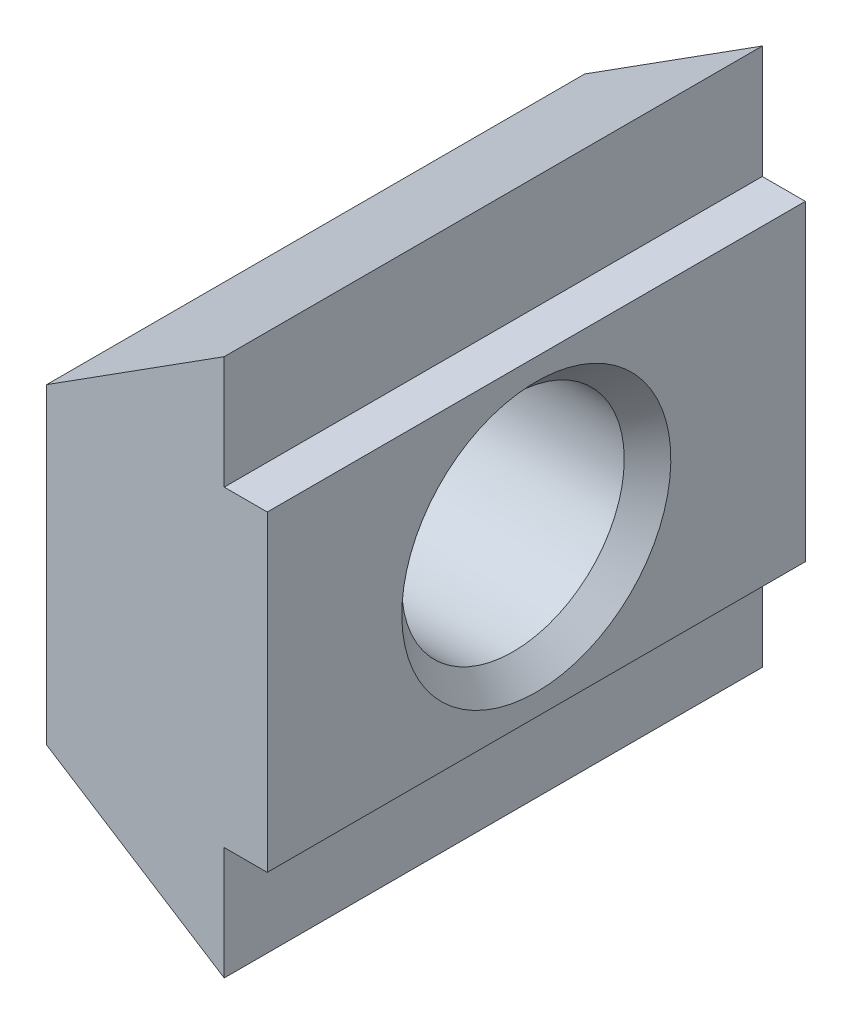
from build123d import *

# Parameters (mm, degrees)
BOSS_EXTRUDE1_DEPTH    = 10
SKETCH2_W              = 10
SKETCH2_H              = 5.8
BOSS_EXTRUDE2_DEPTH    = 0.8
M3_5_CLEARANCE_HOLE1_D = 4.134
CHAMFER1_SIZE          = 0.433


with BuildPart() as part:
    # Sketch1 → Boss-Extrude1 (new body)
    with BuildSketch(Plane.XY.offset(5)):
        Polygon((-0.8, -5), (-0.8, 5), (-4.1, 2.9), (-4.1, -2.9), align=None)
    extrude(amount=-BOSS_EXTRUDE1_DEPTH)

    # Sketch2 → Boss-Extrude2 (add)
    with BuildSketch(Plane(origin=(-0.8, 0, 0), x_dir=(0, 0, -1), z_dir=(1, 0, 0))):
        Rectangle(SKETCH2_W, SKETCH2_H)
    extrude(amount=BOSS_EXTRUDE2_DEPTH)

    # M3.5 Clearance Hole1 (through all)
    with Locations(Plane.ZY.offset(4.1)):
        with Locations((0, 0)):
            Hole(M3_5_CLEARANCE_HOLE1_D / 2)

    # Chamfer1
    chamfer1_edges = [part.edges().sort_by_distance(p)[0] for p in [
        (-4.1, 0, 2.067),
        (0, 0, 2.067),
    ]]
    chamfer(chamfer1_edges, length=CHAMFER1_SIZE)


solid = part.part
